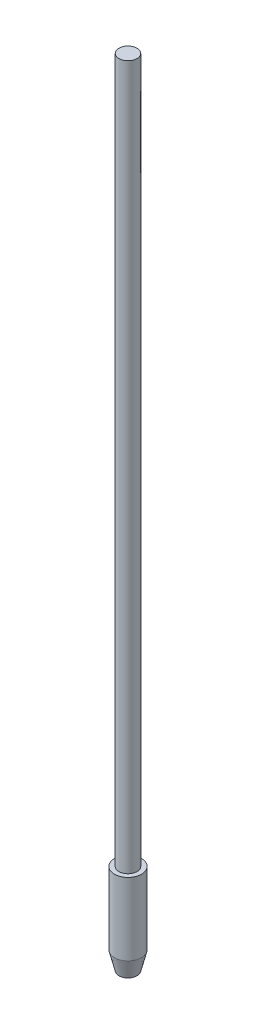
from build123d import *

# Parameters (mm, degrees)
SKETCH19_R          = 5
BOSS_EXTRUDE1_DEPTH = 390
SKETCH25_R          = 7.5
BOSS_EXTRUDE2_DEPTH = 40
SKETCH26_R          = 7.5
SKETCH27_R          = 5


with BuildPart() as part:
    # Sketch19 → Boss-Extrude1 (new body)
    with BuildSketch(Plane(origin=(0, 0, 0), x_dir=(1, 0, 0), z_dir=(0, 1, 0))):
        with Locations(Location((276.355570331, 125.849309684, 0), (0, 0, 270))):
            Circle(SKETCH19_R)
    extrude(amount=-BOSS_EXTRUDE1_DEPTH)

    # Sketch25 → Boss-Extrude2 (add)
    with BuildSketch(Plane.XZ.offset(390)):
        with Locations(Location((276.355570331, -125.849309684, 0), (0, 0, 270))):
            Circle(SKETCH25_R)
    extrude(amount=BOSS_EXTRUDE2_DEPTH)

    # Sketch26 → Loft1 section 0
    with BuildSketch(Plane.XZ.offset(430)):
        with Locations((276.355570331, -125.849309684)):
            Circle(SKETCH26_R)
    # Sketch27 → Loft1 section 1
    with BuildSketch(Plane(origin=(0, -440, 0), x_dir=(-1, 0, 0), z_dir=(0, -1, 0))):
        with Locations((-276.355570331, 125.849309684)):
            Circle(SKETCH27_R)
    loft()


solid = part.part
